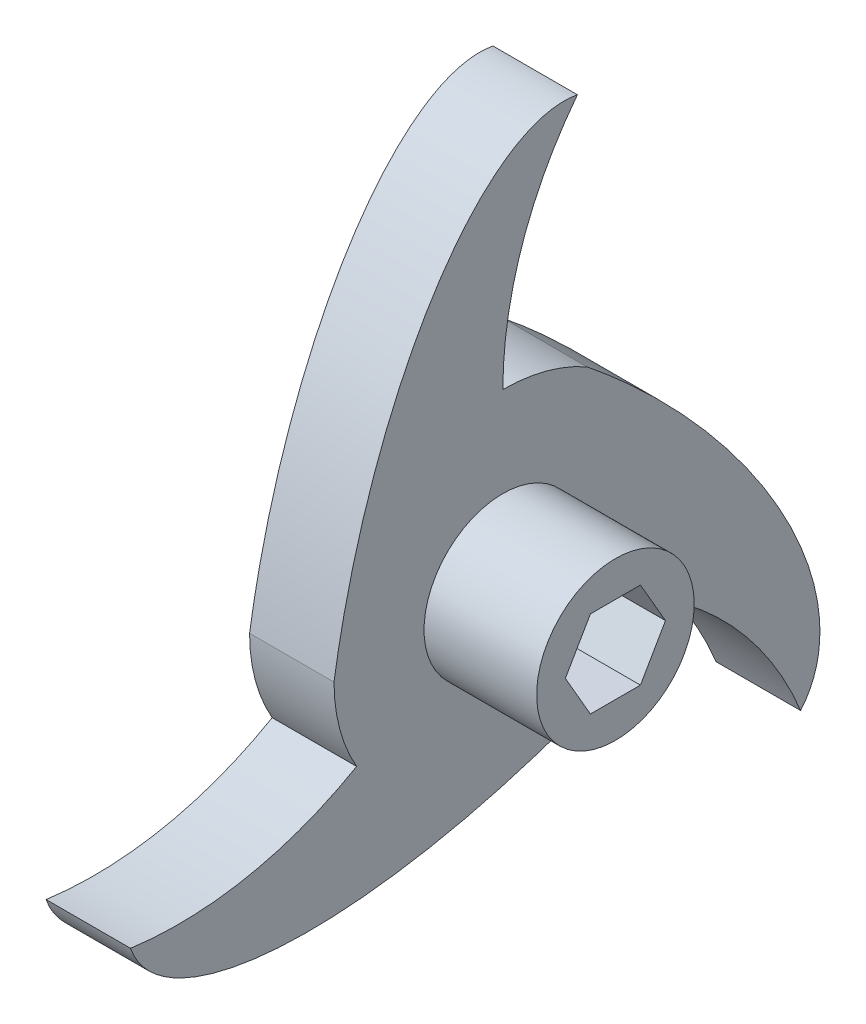
from build123d import *

# Parameters (mm, degrees)
BOSS_EXTRUDE2_DEPTH = 9.525
SKETCH1_7_R         = 8.89
BOSS_EXTRUDE4_DEPTH = 22.225


with BuildPart() as part:
    # Sketch1 → Boss-Extrude2 (new body)
    with BuildSketch(Plane(origin=(0, 0, 0), x_dir=(0, 0, -1), z_dir=(1, 0, 0))):
        with BuildLine():
            ThreePointArc((9.525, 16.497783942), (4.930502809, 18.400886991), (0, 19.05))
            ThreePointArc((0, 19.05), (2.161493982, 32.047813076), (8.413309173, 43.646520237))
            add(Edge.make_bspline(
                [(8.413309173, 43.646520237), (3.572991313, 44.579540565), (-2.983083494, 41.836213327), (-9.860033792, 32.789051702), (-14.919789948, 19.175608051), (-18.015988155, 5.633638353), (-18.31734725, 4.197175442), (-18.589544271, 2.776695083), (-18.833400518, 1.3765002), (-19.05, 0)],
                knots=[3.141592654, 3.141592654, 3.141592654, 3.141592654, 3.141592654, 3.141592654, 4.617024129, 4.617024129, 4.617024129, 4.617024129, 4.793596405, 4.793596405, 4.793596405, 4.793596405, 4.793596405, 4.793596405], degree=5, weights=[1, 1, 0.97421635, 0.97065359, 1, 1, 1.000001514, 1.000002053, 1, 1]))
            ThreePointArc((-19.05, 0), (-18.400886991, -4.930502809), (-16.497783942, -9.525))
            ThreePointArc((-16.497783942, -9.525), (-28.83496725, -14.151997839), (-42.005649898, -14.537120645))
            add(Edge.make_bspline(
                [(-42.005649898, -14.537120645), (-40.393510275, -19.195469038), (-34.739681792, -23.501532751), (-23.466134844, -24.933565597), (-9.146668731, -22.508721139), (4.129120148, -18.419122593), (5.523813068, -17.961875769), (6.890083655, -17.487365125), (8.224616117, -16.998453388), (9.525, -16.497783942)],
                knots=[0, 0, 0, 0, 0, 0, 1.475431476, 1.475431476, 1.475431476, 1.475431476, 1.652003752, 1.652003752, 1.652003752, 1.652003752, 1.652003752, 1.652003752], degree=5, weights=[1, 1, 0.97421635, 0.97065359, 1, 1, 1.000001514, 1.000002053, 1, 1]))
            ThreePointArc((9.525, -16.497783942), (13.470384182, -13.470384182), (16.497783942, -9.525))
            ThreePointArc((16.497783942, -9.525), (26.673473268, -17.895815237), (33.592340725, -29.109399592))
            add(Edge.make_bspline(
                [(33.592340725, -29.109399592), (36.820518962, -25.384071527), (37.722765286, -18.334680576), (33.326168636, -7.855486105), (24.066458679, 3.333113088), (13.886868007, 12.78548424), (12.793534182, 13.764700327), (11.699460616, 14.710670041), (10.6087844, 15.621953188), (9.525, 16.497783942)],
                knots=[0, 0, 0, 0, 0, 0, 1.475431476, 1.475431476, 1.475431476, 1.475431476, 1.652003752, 1.652003752, 1.652003752, 1.652003752, 1.652003752, 1.652003752], degree=5, weights=[1, 1, 0.97421635, 0.97065359, 1, 1, 1.000001514, 1.000002053, 1, 1]))
        make_face()
        Polygon((5.645908282, 0), (2.822954141, -4.8895), (-2.822954141, -4.8895), (-5.645908282, 0), (-2.822954141, 4.8895), (2.822954141, 4.8895), align=None, mode=Mode.SUBTRACT)
    extrude(amount=BOSS_EXTRUDE2_DEPTH)

    # Sketch1<7> → Boss-Extrude4 (add)
    with BuildSketch(Plane(origin=(0, 0, 0), x_dir=(0, 0, -1), z_dir=(1, 0, 0))):
        Circle(SKETCH1_7_R)
        Polygon((2.822954141, 4.8895), (5.645908282, 0), (2.822954141, -4.8895), (-2.822954141, -4.8895), (-5.645908282, 0), (-2.822954141, 4.8895), align=None, mode=Mode.SUBTRACT)
    extrude(amount=BOSS_EXTRUDE4_DEPTH)


solid = part.part
